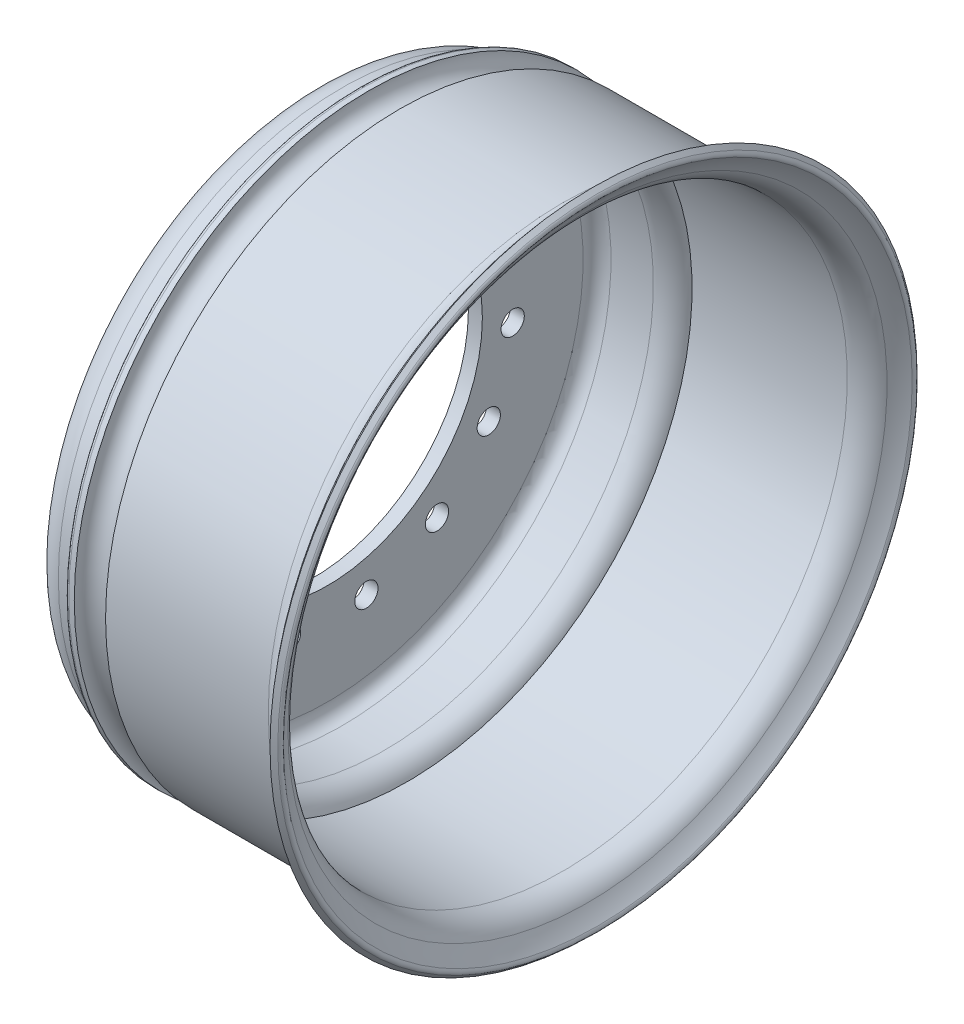
from build123d import *

# Parameters (mm, degrees)
SKETCH2_R          = 7.5
CUT_EXTRUDE1_DEPTH = 349.265230313
CIRPATTERN1_COUNT  = 15
FILLET1_R          = 2.5


with BuildPart() as part:
    # Sketch1 → Revolve1 (revolve)
    with BuildSketch(Plane.XY, mode=Mode.PRIVATE) as revolve1_sk:
        with BuildLine():
            Line((0, 190), (6, 190))
            ThreePointArc((6, 190), (15.897788702, 179.800105782), (25.997991865, 189.799603736))
            Line((25.997991865, 189.799603736), (130.997991865, 189.799603736))
            ThreePointArc((130.997991865, 189.799603736), (137.323688724, 191.518344104), (141.909828695, 196.201914256))
            ThreePointArc((141.909828695, 196.201914256), (146.082058847, 202.723059885), (151, 208.701914256))
            Line((151, 208.701914256), (155.398588943, 204.621177151))
            ThreePointArc((155.398588943, 204.621177151), (150.934611589, 199.19421703), (147.147510374, 193.275023305))
            ThreePointArc((147.147510374, 193.275023305), (140.360023216, 186.34333948), (130.997991865, 183.799603736))
            Line((130.997991865, 183.799603736), (30.830388839, 183.799603736))
            ThreePointArc((30.830388839, 183.799603736), (24.897523585, 176.503050229), (15.890197485, 173.799966853))
            Line((15.890197485, 173.799966853), (-11.468099829, 173.799966853))
            ThreePointArc((-11.468099829, 173.799966853), (-17.832060859, 171.163927884), (-20.468099829, 164.799966853))
            Line((-20.468099829, 164.799966853), (-20.468099829, 99.799966853))
            Line((-20.468099829, 99.799966853), (-29.468099829, 99.799966853))
            Line((-29.468099829, 99.799966853), (-29.468099829, 164.799966853))
            ThreePointArc((-29.468099829, 164.799966853), (-24.19602189, 177.527888914), (-11.468099829, 182.799966853))
            Line((-11.468099829, 182.799966853), (1.610320632, 182.799966853))
            ThreePointArc((1.610320632, 182.799966853), (1.335926615, 183.394617975), (1.086097401, 184))
            Line((1.086097401, 184), (0, 184))
            Line((0, 184), (0, 190))
        make_face()
    revolve(revolve1_sk.sketch.rotate(Axis((0, 0, 0), (1, 0, 0)), 90), axis=Axis((0, 0, 0), (1, 0, 0)))

    # Sketch2 → Cut-Extrude1 (cut, through all)
    with BuildSketch(Plane.ZY.offset(29.468099829)):
        with Locations((0, 120)):
            Circle(SKETCH2_R)
    cut_extrude1 = extrude(amount=-CUT_EXTRUDE1_DEPTH, mode=Mode.SUBTRACT)

    # CirPattern1: Cut-Extrude1 ×15 about axis
    cirpattern1_axis = Axis((0, 0, 0), (1, 0, 0))
    for i in range(1, CIRPATTERN1_COUNT):
        add(cut_extrude1.rotate(cirpattern1_axis, i * 360 / CIRPATTERN1_COUNT), mode=Mode.SUBTRACT)

    # Fillet1
    fillet1_edges = [part.edges().sort_by_distance(p)[0] for p in [
        (0, 0, -190),
        (155.398588943, 0, -204.621177151),
    ]]
    fillet(fillet1_edges, radius=FILLET1_R)


solid = part.part
